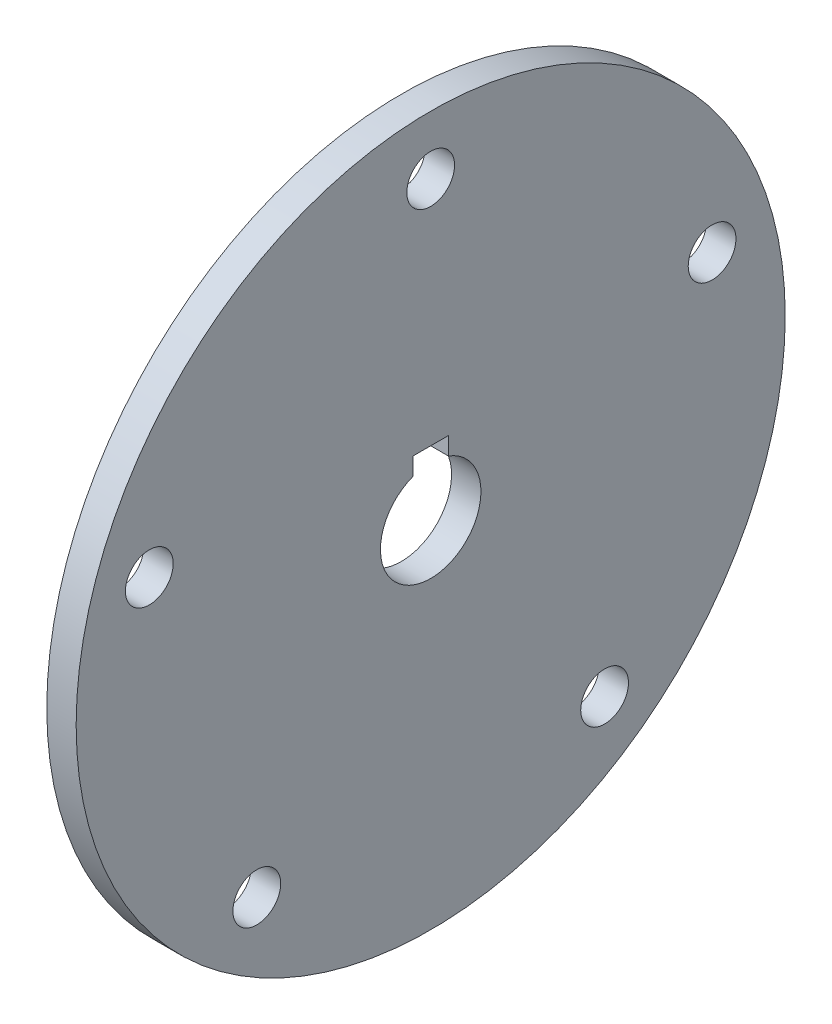
from build123d import *

# Parameters (mm, degrees)
SKETCH1_R           = 60.325
BOSS_EXTRUDE1_DEPTH = 2.5
SKETCH2_R           = 4.064
CUT_EXTRUDE1_DEPTH  = 86.458827806
CUT_EXTRUDE4_DEPTH  = 86.458827806


with BuildPart() as part:
    # Sketch1 → Boss-Extrude1 (new, symmetric)
    with BuildSketch(Plane(origin=(0, 0, 0), x_dir=(0, 0, -1), z_dir=(1, 0, 0))):
        Circle(SKETCH1_R)
    extrude(amount=BOSS_EXTRUDE1_DEPTH, both=True)

    # Sketch2 → Cut-Extrude1 (cut, through all)
    with BuildSketch(Plane.ZY.offset(2.5)):
        with Locations((0, 50.342959834)):
            Circle(SKETCH2_R)
        with Locations((47.879, 15.556830136)):
            Circle(SKETCH2_R)
        with Locations((29.590849347, -40.728310053)):
            Circle(SKETCH2_R)
        with Locations((-29.590849347, -40.728310053)):
            Circle(SKETCH2_R)
        with Locations((-47.879, 15.556830136)):
            Circle(SKETCH2_R)
    extrude(amount=-CUT_EXTRUDE1_DEPTH, mode=Mode.SUBTRACT)

    # Sketch8 → Cut-Extrude4 (cut, through all)
    with BuildSketch(Plane(origin=(2.5, 0, 0), x_dir=(0, 0, -1), z_dir=(1, 0, 0))):
        with BuildLine():
            Line((0, 11.006403687), (-3, 11.006403687))
            Line((-3, 11.006403687), (-3, 8.006403687))
            ThreePointArc((-3, 8.006403687), (0, -8.55), (3, 8.006403687))
            Line((3, 8.006403687), (3, 11.006403687))
            Line((3, 11.006403687), (0, 11.006403687))
        make_face()
    extrude(amount=-CUT_EXTRUDE4_DEPTH, mode=Mode.SUBTRACT)


solid = part.part
